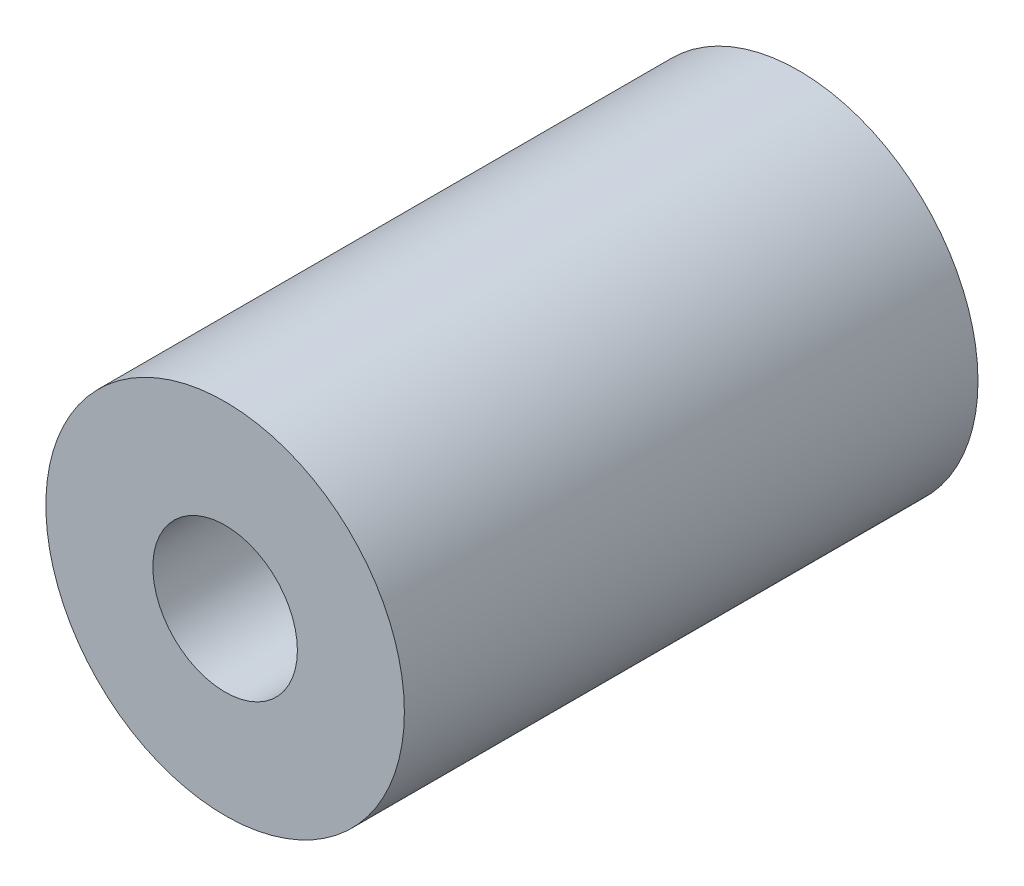
from build123d import *

# Parameters (mm, degrees)
SKETCH1_R      = 7.9375
SKETCH1_R_2    = 3.2004
EXTRUDE1_DEPTH = 12.7


with BuildPart() as part:
    # Sketch1 → Extrude1 (new, symmetric)
    with BuildSketch(Plane.XY):
        Circle(SKETCH1_R)
        Circle(SKETCH1_R_2, mode=Mode.SUBTRACT)
    extrude(amount=EXTRUDE1_DEPTH, both=True)


solid = part.part
